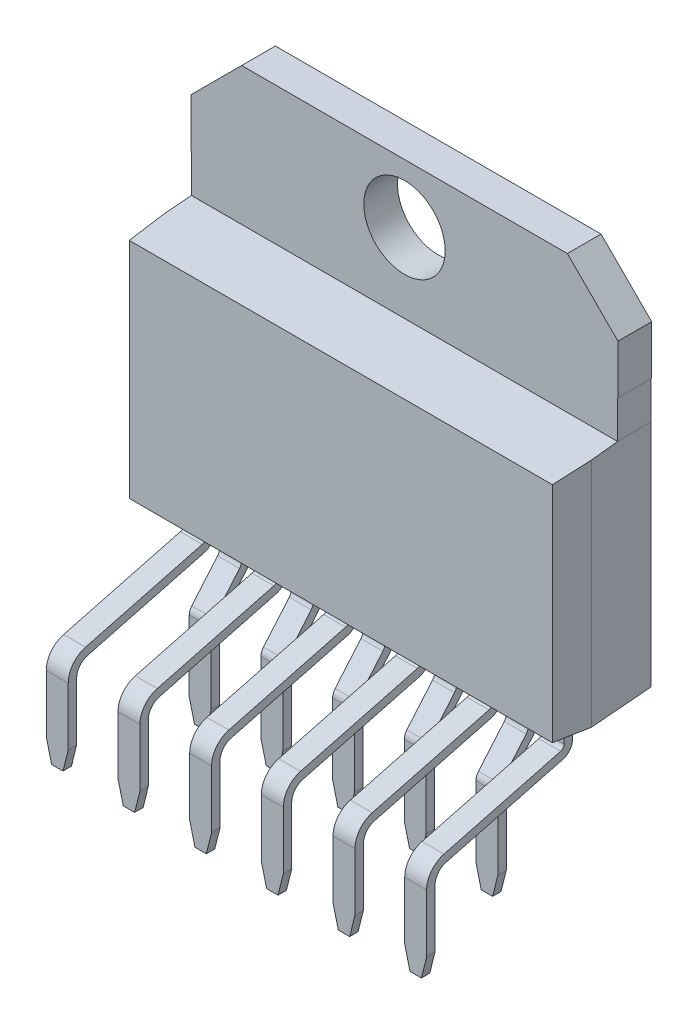
from build123d import *
from OCP.BRepFilletAPI import BRepFilletAPI_MakeChamfer

# Parameters (mm, degrees)
EXTRUDE_1_DEPTH            = 10.135
CUT_EXTRUDE_1_DEPTH        = 11.1
SKETCH_3_R                 = 1.93
EXTRUDE_2_DEPTH            = 1.6
CUT_EXTRUDE_2_DEPTH        = 1.8
SKETCH_6_W                 = 1.04
SKETCH_6_H                 = 0.4
PATTERN_LINEAR_1_COUNT     = 3
PATTERN_LINEAR_1_PITCH     = 3.4
PATTERN_LINEAR_1_COL_COUNT = 3
PATTERN_LINEAR_1_COL_PITCH = 3.4
SKETCH_8_W                 = 1.04
SKETCH_8_H                 = 0.4
PATTERN_LINEAR_2_COUNT     = 6
PATTERN_LINEAR_2_PITCH     = 3.4
CHAMFER_1_SIZE             = 0.25
CHAMFER_1_SIZE2            = 1


with BuildPart() as part:
    # Эскиз1 → Бобышка-Вытянуть1 (new, symmetric)
    with BuildSketch(Plane(origin=(0, 0, 0), x_dir=(0, 0, -1), z_dir=(1, 0, 0))):
        Polygon((-4.62, 5.3), (-4.62, -5.3), (-2.85, -5.5), (0, -5.3), (0, 5.6), (-1.6, 5.6), align=None)
    extrude(amount=EXTRUDE_1_DEPTH, both=True)

    # Эскиз2 → Вырез-Вытянуть1 (cut)
    with BuildSketch(Plane(origin=(0, 5.6, 0), x_dir=(1, 0, 0), z_dir=(0, 1, 0))):
        Polygon((-10.135, 0), (-10.135, -4.62), (-10.035, -4.62), (-10.125, -2.85), (-10.085, 0), align=None)
        Polygon((10.085, 0), (10.135, 0), (10.135, -4.62), (10.035, -4.62), (10.125, -2.85), align=None)
    extrude(amount=-CUT_EXTRUDE_1_DEPTH, mode=Mode.SUBTRACT)

    # По траектории2: sweep along a path in Эскиз5
    with BuildLine(Plane(origin=(0, 0, 0), x_dir=(0, 0, -1), z_dir=(1, 0, 0))) as sweep_2_path:
        Line((-2.85, 0), (-2.85, -6.777288471))
        ThreePointArc((-2.85, -6.777288471), (-2.886934922, -6.984550909), (-2.993192394, -7.16629594))
        Line((-2.993192394, -7.16629594), (-4.218403803, -8.605049522))
        ThreePointArc((-4.218403803, -8.605049522), (-4.271532539, -8.695922037), (-4.29, -8.799553256))
        Line((-4.29, -8.799553256), (-4.29, -13.16))
    # Эскиз6 → По траектории2 (sweep)
    with BuildSketch(Plane(origin=(0, 0, 0), x_dir=(1, 0, 0), z_dir=(0, 1, 0))):
        with Locations((0, -2.85)):
            Rectangle(SKETCH_6_W, SKETCH_6_H)
    sweep_2 = sweep(path=sweep_2_path.line)

    # Линейный массив1: По траектории2 ×3
    with Locations(*[(-i * PATTERN_LINEAR_1_PITCH, 0, 0) for i in range(1, PATTERN_LINEAR_1_COUNT)]):
        add(sweep_2)

    # Линейный массив1 col: По траектории2 ×3
    with Locations(*[(i * PATTERN_LINEAR_1_COL_PITCH, 0, 0) for i in range(1, PATTERN_LINEAR_1_COL_COUNT)]):
        add(sweep_2)

    # По траектории3: sweep along a path in Эскиз7
    with BuildLine(Plane(origin=(-8.5, 0, 0), x_dir=(0, 0, -1), z_dir=(1, 0, 0))) as sweep_3_path:
        Line((-9.37, -13.122232844), (-9.37, -9.382232844))
        ThreePointArc((-9.37, -9.382232844), (-9.182731483, -8.832674992), (-8.69885815, -8.511816882))
        Line((-8.69885815, -8.511816882), (-3.161563499, -7.055898028))
        ThreePointArc((-3.161563499, -7.055898028), (-2.936935473, -6.906946394), (-2.85, -6.651825711))
        Line((-2.85, -6.651825711), (-2.85, 0))
    # Эскиз8 → По траектории3 (sweep)
    with BuildSketch(Plane(origin=(0, 0, 0), x_dir=(1, 0, 0), z_dir=(0, 1, 0))):
        with Locations((-8.5, -2.85)):
            Rectangle(SKETCH_8_W, SKETCH_8_H)
    sweep_3 = sweep(path=sweep_3_path.line)

    # Линейный массив2: По траектории3 ×6
    with Locations(*[(i * PATTERN_LINEAR_2_PITCH, 0, 0) for i in range(1, PATTERN_LINEAR_2_COUNT)]):
        add(sweep_3)

    # Фаска1: one chamfer whose edges measure the first distance from different faces: ONE call of the kernel's chamfer builder (chamfer() names one face for all edges)
    chamfer_1_edges_1 = [part.edges().sort_by_distance(p)[0] for p in [
        (3.92, -13.16, 4.29),
        (2.88, -13.16, 4.29),
    ]]
    chamfer_1_side_1 = [part.faces().sort_by_distance(p)[0] for p in [
        (3.4, -13.16, 4.29),
    ]]
    chamfer_1_edges_2 = [part.edges().sort_by_distance(p)[0] for p in [
        (7.32, -13.16, 4.29),
        (6.28, -13.16, 4.29),
    ]]
    chamfer_1_side_2 = [part.faces().sort_by_distance(p)[0] for p in [
        (6.8, -13.16, 4.29),
    ]]
    chamfer_1_edges_3 = [part.edges().sort_by_distance(p)[0] for p in [
        (-2.88, -13.16, 4.29),
        (-3.92, -13.16, 4.29),
    ]]
    chamfer_1_side_3 = [part.faces().sort_by_distance(p)[0] for p in [
        (-3.4, -13.16, 4.29),
    ]]
    chamfer_1_edges_4 = [part.edges().sort_by_distance(p)[0] for p in [
        (-6.28, -13.16, 4.29),
        (-7.32, -13.16, 4.29),
    ]]
    chamfer_1_side_4 = [part.faces().sort_by_distance(p)[0] for p in [
        (-6.8, -13.16, 4.29),
    ]]
    chamfer_1_edges_5 = [part.edges().sort_by_distance(p)[0] for p in [
        (-9.02, -13.122232844, 9.37),
        (-7.98, -13.122232844, 9.37),
    ]]
    chamfer_1_side_5 = [part.faces().sort_by_distance(p)[0] for p in [
        (-8.5, -13.122232844, 9.37),
    ]]
    chamfer_1_edges_6 = [part.edges().sort_by_distance(p)[0] for p in [
        (-5.62, -13.122232844, 9.37),
        (-4.58, -13.122232844, 9.37),
    ]]
    chamfer_1_side_6 = [part.faces().sort_by_distance(p)[0] for p in [
        (-5.1, -13.122232844, 9.37),
    ]]
    chamfer_1_edges_7 = [part.edges().sort_by_distance(p)[0] for p in [
        (-2.22, -13.122232844, 9.37),
        (-1.18, -13.122232844, 9.37),
    ]]
    chamfer_1_side_7 = [part.faces().sort_by_distance(p)[0] for p in [
        (-1.7, -13.122232844, 9.37),
    ]]
    chamfer_1_edges_8 = [part.edges().sort_by_distance(p)[0] for p in [
        (1.18, -13.122232844, 9.37),
        (2.22, -13.122232844, 9.37),
    ]]
    chamfer_1_side_8 = [part.faces().sort_by_distance(p)[0] for p in [
        (1.7, -13.122232844, 9.37),
    ]]
    chamfer_1_edges_9 = [part.edges().sort_by_distance(p)[0] for p in [
        (4.58, -13.122232844, 9.37),
        (5.62, -13.122232844, 9.37),
    ]]
    chamfer_1_side_9 = [part.faces().sort_by_distance(p)[0] for p in [
        (5.1, -13.122232844, 9.37),
    ]]
    chamfer_1_edges_10 = [part.edges().sort_by_distance(p)[0] for p in [
        (7.98, -13.122232844, 9.37),
        (9.02, -13.122232844, 9.37),
    ]]
    chamfer_1_side_10 = [part.faces().sort_by_distance(p)[0] for p in [
        (8.5, -13.122232844, 9.37),
    ]]
    chamfer_1_edges_11 = [part.edges().sort_by_distance(p)[0] for p in [
        (0.52, -13.16, 4.29),
        (-0.52, -13.16, 4.29),
    ]]
    chamfer_1_side_11 = [part.faces().sort_by_distance(p)[0] for p in [
        (0, -13.16, 4.29),
    ]]
    chamfer_1 = BRepFilletAPI_MakeChamfer(part.part.solid().wrapped)
    for e in chamfer_1_edges_1:
        chamfer_1.Add(CHAMFER_1_SIZE, CHAMFER_1_SIZE2, e.wrapped, chamfer_1_side_1[0].wrapped)  # the first distance lies on this face
    for e in chamfer_1_edges_2:
        chamfer_1.Add(CHAMFER_1_SIZE, CHAMFER_1_SIZE2, e.wrapped, chamfer_1_side_2[0].wrapped)  # the first distance lies on this face
    for e in chamfer_1_edges_3:
        chamfer_1.Add(CHAMFER_1_SIZE, CHAMFER_1_SIZE2, e.wrapped, chamfer_1_side_3[0].wrapped)  # the first distance lies on this face
    for e in chamfer_1_edges_4:
        chamfer_1.Add(CHAMFER_1_SIZE, CHAMFER_1_SIZE2, e.wrapped, chamfer_1_side_4[0].wrapped)  # the first distance lies on this face
    for e in chamfer_1_edges_5:
        chamfer_1.Add(CHAMFER_1_SIZE, CHAMFER_1_SIZE2, e.wrapped, chamfer_1_side_5[0].wrapped)  # the first distance lies on this face
    for e in chamfer_1_edges_6:
        chamfer_1.Add(CHAMFER_1_SIZE, CHAMFER_1_SIZE2, e.wrapped, chamfer_1_side_6[0].wrapped)  # the first distance lies on this face
    for e in chamfer_1_edges_7:
        chamfer_1.Add(CHAMFER_1_SIZE, CHAMFER_1_SIZE2, e.wrapped, chamfer_1_side_7[0].wrapped)  # the first distance lies on this face
    for e in chamfer_1_edges_8:
        chamfer_1.Add(CHAMFER_1_SIZE, CHAMFER_1_SIZE2, e.wrapped, chamfer_1_side_8[0].wrapped)  # the first distance lies on this face
    for e in chamfer_1_edges_9:
        chamfer_1.Add(CHAMFER_1_SIZE, CHAMFER_1_SIZE2, e.wrapped, chamfer_1_side_9[0].wrapped)  # the first distance lies on this face
    for e in chamfer_1_edges_10:
        chamfer_1.Add(CHAMFER_1_SIZE, CHAMFER_1_SIZE2, e.wrapped, chamfer_1_side_10[0].wrapped)  # the first distance lies on this face
    for e in chamfer_1_edges_11:
        chamfer_1.Add(CHAMFER_1_SIZE, CHAMFER_1_SIZE2, e.wrapped, chamfer_1_side_11[0].wrapped)  # the first distance lies on this face
    add(Compound.cast(chamfer_1.Shape()), mode=Mode.REPLACE)


with BuildPart() as body_2:
    # Эскиз3 → Бобышка-Вытянуть2 (new body)
    with BuildSketch(Plane.XY):
        Polygon((-10.125, 9.73), (-10.125, 5.6), (10.125, 5.6), (10.125, 9.73), (7.725, 12.13), (-7.725, 12.13), align=None)
        with Locations((0, 9.34)):
            Circle(SKETCH_3_R, mode=Mode.SUBTRACT)
    extrude(amount=EXTRUDE_2_DEPTH)

    # Эскиз4 → Вырез-Вытянуть2 (cut)
    with BuildSketch(Plane.XZ.offset(-5.6)):
        Polygon((-10.10745614, 1.6), (-10.085, 0), (-10.125, 0), (-10.125, 1.6), align=None)
        Polygon((10.125, 0), (10.085, 0), (10.10745614, 1.6), (10.125, 1.6), align=None)
    extrude(amount=-CUT_EXTRUDE_2_DEPTH, mode=Mode.SUBTRACT)


solid = Compound([part.part, body_2.part])
